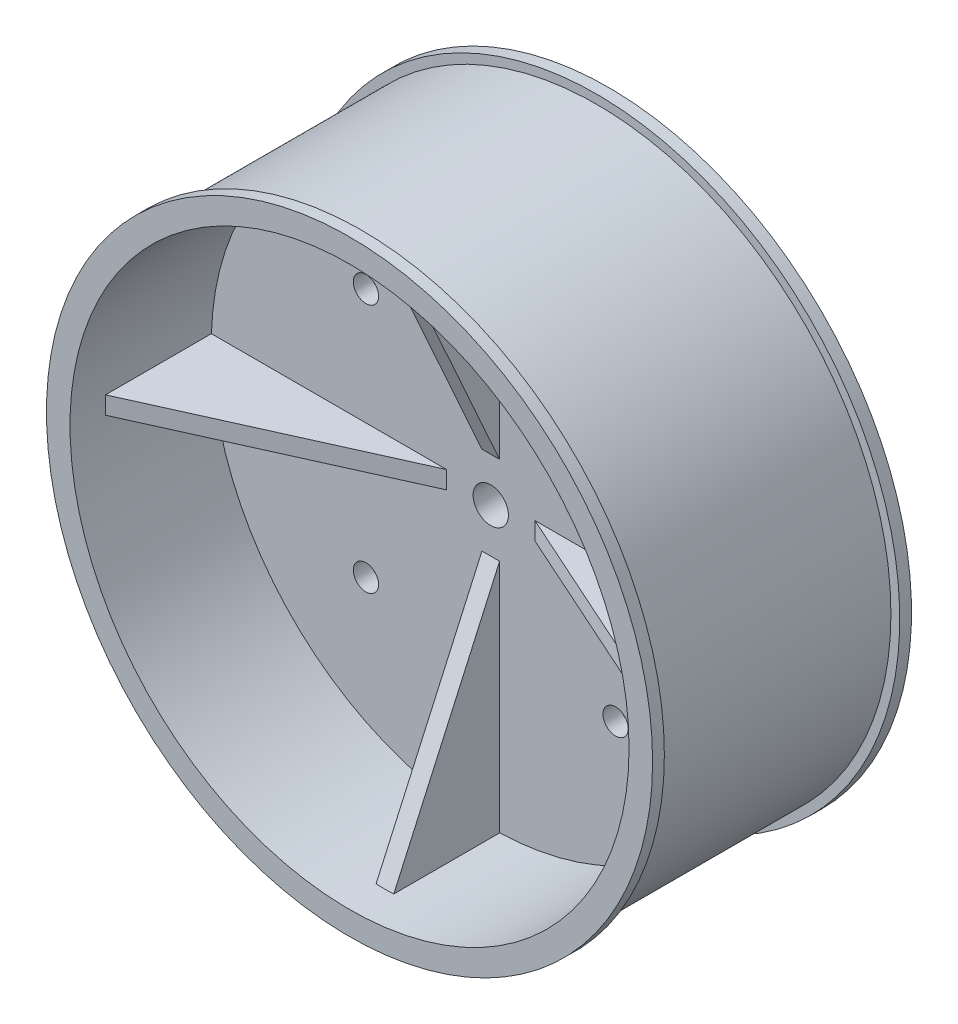
from build123d import *

# Parameters (mm, degrees)
SKETCH1_R               = 50
SKETCH1_R_2             = 47.5
BOSS_EXTRUDE1_DEPTH     = 40
SKETCH2_R               = 51.5
SKETCH2_R_2             = 47.5
BOSS_EXTRUDE2_DEPTH     = 2
BOSS_EXTRUDE3_START     = 2
SKETCH3_R               = 51.5
SKETCH3_R_2             = 47.5
BOSS_EXTRUDE3_DEPTH     = 2
SKETCH4_R               = 47.5
BOSS_EXTRUDE4_DEPTH     = 3
SKETCH5_R               = 8
BOSS_EXTRUDE5_DEPTH     = 25
SKETCH6_R               = 5
BOSS_EXTRUDE6_DEPTH     = 26.25
BOSS_EXTRUDE7_DEPTH     = 1.5
BOSS_EXTRUDE8_DEPTH     = 1.5
BOSS_EXTRUDE9_DEPTH     = 1.5
BOSS_EXTRUDE10_DEPTH    = 1.5
CUT_EXTRUDE1_DEPTH      = 91.222294917
CUT_EXTRUDE1_DEPTH_BACK = 91.222294917
SKETCH12_R              = 3
SKETCH13_R              = 4
CUT_EXTRUDE2_DEPTH      = 20
SKETCH14_R              = 1.5
CUT_EXTRUDE3_DEPTH      = 20
SKETCH15_R              = 2.15
CUT_EXTRUDE4_DEPTH      = 79.48606568


with BuildPart() as part:
    # Sketch1 → Boss-Extrude1 (new body)
    with BuildSketch(Plane.XY):
        Circle(SKETCH1_R)
        Circle(SKETCH1_R_2, mode=Mode.SUBTRACT)
    extrude(amount=BOSS_EXTRUDE1_DEPTH)

    # Sketch2 → Boss-Extrude2 (add)
    with BuildSketch(Plane.XY.offset(40)):
        Circle(SKETCH2_R)
        Circle(SKETCH2_R_2, mode=Mode.SUBTRACT)
    extrude(amount=BOSS_EXTRUDE2_DEPTH)

    # Sketch3 → Boss-Extrude3 (add)
    with BuildSketch(Plane(origin=(0, 0, 0), x_dir=(-1, 0, 0), z_dir=(0, 0, -1)).offset(BOSS_EXTRUDE3_START)):
        with Locations(Location((0, 0, 0), (0, 0, 180))):
            Circle(SKETCH3_R)
        Circle(SKETCH3_R_2, mode=Mode.SUBTRACT)
    extrude(amount=-BOSS_EXTRUDE3_DEPTH)

    # Sketch4 → Boss-Extrude4 (add)
    with BuildSketch(Plane(origin=(0, 0, 15), x_dir=(-1, 0, 0), z_dir=(0, 0, -1))):
        Circle(SKETCH4_R)
    extrude(amount=-BOSS_EXTRUDE4_DEPTH)

    # Sketch5 → Boss-Extrude5 (add)
    with BuildSketch(Plane(origin=(0, 0, 15), x_dir=(-1, 0, 0), z_dir=(0, 0, -1))):
        Circle(SKETCH5_R)
    extrude(amount=BOSS_EXTRUDE5_DEPTH)

    # Sketch6 → Boss-Extrude6 (add)
    with BuildSketch(Plane(origin=(0, 0, 15), x_dir=(-1, 0, 0), z_dir=(0, 0, -1))):
        Circle(SKETCH6_R)
    extrude(amount=BOSS_EXTRUDE6_DEPTH)

    # Sketch7 → Boss-Extrude7 (add, symmetric)
    with BuildSketch(Plane(origin=(0, 0, 0), x_dir=(1, 0, 0), z_dir=(0, 1, 0))):
        Polygon((-47.5, -15), (-5, -15), (-47.5, -4), align=None)
        Polygon((47.5, -15), (47.5, -4), (5, -15), align=None)
    extrude(amount=BOSS_EXTRUDE7_DEPTH, both=True)

    # Sketch8 → Boss-Extrude8 (add, symmetric)
    with BuildSketch(Plane(origin=(0, 0, 0), x_dir=(0, 0, -1), z_dir=(1, 0, 0))):
        Polygon((-15, -49), (-4, -49), (-15, -5), align=None)
        Polygon((-15, 5), (-15, 49), (-4, 49), align=None)
    extrude(amount=BOSS_EXTRUDE8_DEPTH, both=True)

    # Sketch10 → Boss-Extrude9 (add, symmetric)
    with BuildSketch(Plane(origin=(0, 0, 0), x_dir=(1, 0, 0), z_dir=(0, 1, 0))):
        Polygon((-47.5, -18), (-47.5, -36), (-7.5, -18), align=None)
        Polygon((7.5, -18), (47.5, -18), (47.5, -36), align=None)
    extrude(amount=BOSS_EXTRUDE9_DEPTH, both=True)

    # Sketch11 → Boss-Extrude10 (add, symmetric)
    with BuildSketch(Plane(origin=(0, 0, 0), x_dir=(0, 0, -1), z_dir=(1, 0, 0))):
        Polygon((-18, 47.5), (-36, 47.5), (-18, 7.5), align=None)
        Polygon((-18, -7.5), (-18, -47.5), (-36, -47.5), align=None)
    extrude(amount=BOSS_EXTRUDE10_DEPTH, both=True)

    # Sketch12 → Cut-Extrude1 (cut, two sides: drawn at the far end of the back side and taken through both)
    with BuildSketch(Plane(origin=(0, 0, -11.25), x_dir=(-1, 0, 0), z_dir=(0, 0, -1)).offset(-CUT_EXTRUDE1_DEPTH_BACK)):
        Circle(SKETCH12_R)
    extrude(amount=CUT_EXTRUDE1_DEPTH + CUT_EXTRUDE1_DEPTH_BACK, mode=Mode.SUBTRACT)

    # Sketch13 → Cut-Extrude2 (cut)
    with BuildSketch(Plane(origin=(0, 0, -11.25), x_dir=(-1, 0, 0), z_dir=(0, 0, -1))):
        Circle(SKETCH13_R)
    extrude(amount=-CUT_EXTRUDE2_DEPTH, mode=Mode.SUBTRACT)

    # Sketch14 → Cut-Extrude3 (cut)
    with BuildSketch(Plane(origin=(0, 0, 0), x_dir=(1, 0, 0), z_dir=(0, 1, 0))):
        with Locations(Location((0, 3.5, 0), (0, 0, 90))):
            Circle(SKETCH14_R)
    extrude(amount=CUT_EXTRUDE3_DEPTH, mode=Mode.SUBTRACT)

    # Sketch15 → Cut-Extrude4 (cut, through all)
    with BuildSketch(Plane.XY.offset(18)):
        with Locations((21.213203436, 21.213203436)):
            Circle(SKETCH15_R)
        with Locations((21.213203436, -21.213203436)):
            Circle(SKETCH15_R)
        with Locations((-21.213203436, -21.213203436)):
            Circle(SKETCH15_R)
        with Locations((-21.213203436, 21.213203436)):
            Circle(SKETCH15_R)
    extrude(amount=-CUT_EXTRUDE4_DEPTH, mode=Mode.SUBTRACT)


solid = part.part
